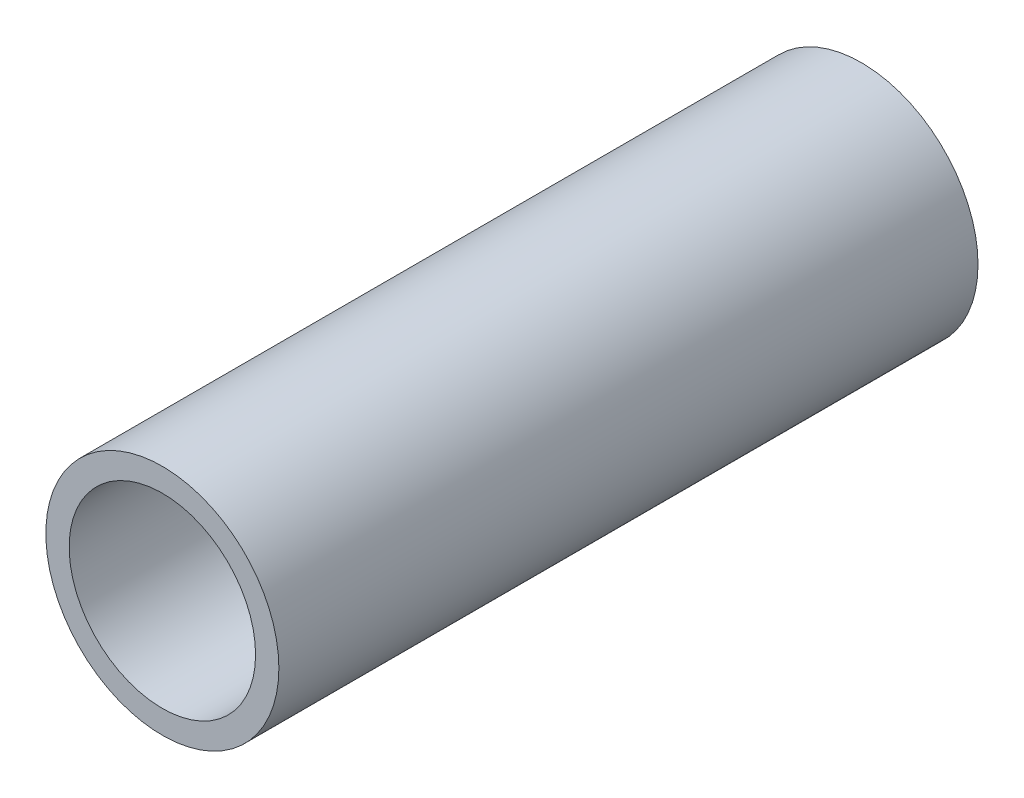
from build123d import *

# Parameters (mm, degrees)
SKETCH1_R           = 25
SKETCH1_R_2         = 20
BOSS_EXTRUDE1_DEPTH = 150


with BuildPart() as part:
    # Sketch1 → Boss-Extrude1 (new body)
    with BuildSketch(Plane.XY):
        Circle(SKETCH1_R)
        Circle(SKETCH1_R_2, mode=Mode.SUBTRACT)
    extrude(amount=BOSS_EXTRUDE1_DEPTH)


solid = part.part
